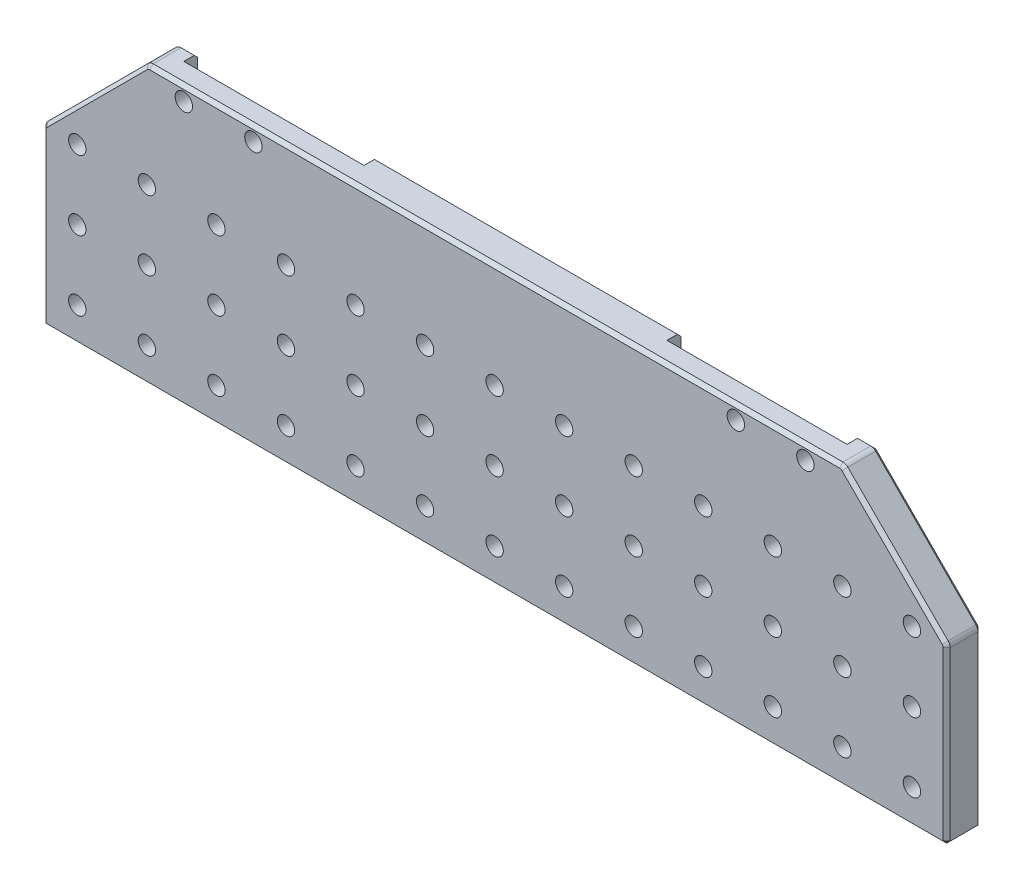
from build123d import *

# Parameters (mm, degrees)
EXTRUDE_1_DEPTH             = 3
EXTRUDE_1_DEPTH_BACK        = 2
SKETCH_2_W                  = 130
SKETCH_2_H                  = 40
SKETCH_6_W                  = 25.903315895
SKETCH_6_H                  = 5
CUT_EXTRUDE_6_DEPTH         = 2
SKETCH_7_R                  = 2.5
CUT_EXTRUDE_7_DEPTH         = 2
CHAMFER_1_SIZE              = 15
M3X0_5_1_D                  = 2.5
M3X0_5_1_DEPTH              = 8.5
M3X0_5_1_TIP                = 0.751075774
FILLET_1_R                  = 1
PATTERN_LINEAR_1_COUNT      = 7
PATTERN_LINEAR_1_PITCH      = 10
PATTERN_LINEAR_1_COUNT_DIR2 = 3
PATTERN_LINEAR_1_PITCH_DIR2 = 10
PATTERN_LINEAR_2_COUNT      = 7
PATTERN_LINEAR_2_PITCH      = 10
PATTERN_LINEAR_2_COUNT_DIR2 = 3
PATTERN_LINEAR_2_PITCH_DIR2 = 10
CHAMFER_2_SIZE              = 0.5


with BuildPart() as part:
    # ｽｹｯﾁ2 → ﾎﾞｽ - 押し出し1 (new, two sides: drawn at the far end of the back side and taken through both)
    with BuildSketch(Plane.XY.offset(-EXTRUDE_1_DEPTH_BACK)):
        with Locations((-80.49999999, -32)):
            Rectangle(SKETCH_2_W, SKETCH_2_H)
    extrude(amount=EXTRUDE_1_DEPTH + EXTRUDE_1_DEPTH_BACK)

    # ｽｹｯﾁ6 → ｶｯﾄ - 押し出し6 (cut)
    with BuildSketch(Plane(origin=(0, 0, -2), x_dir=(-1, 0, 0), z_dir=(0, 0, -1))):
        with Locations((115.230241042, -14.5)):
            Rectangle(SKETCH_6_W, SKETCH_6_H)
        with Locations((45.76975894, -14.5)):
            Rectangle(SKETCH_6_W, SKETCH_6_H)
    extrude(amount=-CUT_EXTRUDE_6_DEPTH, mode=Mode.SUBTRACT)

    # ｽｹｯﾁ7 → ｶｯﾄ - 押し出し7 (cut)
    with BuildSketch(Plane(origin=(0, 0, -2), x_dir=(-1, 0, 0), z_dir=(0, 0, -1))):
        with Locations((33.318100992, -17)):
            Circle(SKETCH_7_R)
        with Locations((128.181898989, -17)):
            Circle(SKETCH_7_R)
        with Locations((102.278583094, -17)):
            Circle(SKETCH_7_R)
        with Locations((58.721416887, -17)):
            Circle(SKETCH_7_R)
    extrude(amount=-CUT_EXTRUDE_7_DEPTH, mode=Mode.SUBTRACT)

    # 面取り1
    chamfer_1_edges = [part.edges().sort_by_distance(p)[0] for p in [
        (-145.49999999, -12, 0.5),
        (-15.49999999, -12, 0.5),
    ]]
    chamfer(chamfer_1_edges, length=CHAMFER_1_SIZE)

    # M3x0.5 ねじ穴1
    with Locations(Plane(origin=(0, 0, 0), x_dir=(-1, 0, 0), z_dir=(0, 0, -1))):
        with Locations((35.818100992, -14), (125.181898989, -14), (45.818100992, -14), (115.181898989, -14)):
            Hole(M3X0_5_1_D / 2, depth=M3X0_5_1_DEPTH)
            with Locations((0, 0, -(M3X0_5_1_DEPTH + M3X0_5_1_TIP / 2))):  # 118° drill point
                Cone(0, M3X0_5_1_D / 2, M3X0_5_1_TIP, mode=Mode.SUBTRACT)

    # ﾌｨﾚｯﾄ1
    fillet_1_edges = [part.edges().sort_by_distance(p)[0] for p in [
        (-30.49999999, -12, 0.5),
        (-130.49999999, -12, 0.5),
        (-145.49999999, -27, 0.5),
        (-15.49999999, -27, 0.5),
    ]]
    fillet(fillet_1_edges, radius=FILLET_1_R)

    # ｽｹｯﾁ11 → M3x0.5 ねじ穴2 (revolve, cut)
    with BuildSketch(Plane(origin=(-80.49999999, -47, -2), x_dir=(0, 1, 0), z_dir=(1, 0, 0))):
        Polygon((0, 0), (0, 9.251075774), (1.25, 8.5), (1.25, 0), align=None)
    m3x0_5_2 = revolve(axis=Axis((-80.49999999, -47, -8.35), (0, 0, 1)), mode=Mode.SUBTRACT)

    # 直線ﾊﾟﾀｰﾝ1: M3x0.5 _2 7 × 3
    with Locations(*[(i * PATTERN_LINEAR_1_PITCH, j * PATTERN_LINEAR_1_PITCH_DIR2, 0) for i in range(PATTERN_LINEAR_1_COUNT) for j in range(PATTERN_LINEAR_1_COUNT_DIR2) if (i, j) != (0, 0)]):
        add(m3x0_5_2, mode=Mode.SUBTRACT)

    # 直線ﾊﾟﾀｰﾝ2: M3x0.5 _2 7 × 3
    with Locations(*[(-i * PATTERN_LINEAR_2_PITCH, j * PATTERN_LINEAR_2_PITCH_DIR2, 0) for i in range(PATTERN_LINEAR_2_COUNT) for j in range(PATTERN_LINEAR_2_COUNT_DIR2) if (i, j) != (0, 0)]):
        add(m3x0_5_2, mode=Mode.SUBTRACT)

    # 面取り2
    chamfer_2_edges = [part.edges().sort_by_distance(p)[0] for p in [
        (-15.49999999, -39.707106781, -2),
        (-80.49999999, -52, 3),
        (-15.49999999, -39.707106781, 3),
        (-145.49999999, -39.707106781, 3),
        (-145.49999999, -39.707106781, -2),
        (-137.99999999, -19.5, -2),
        (-31.866157273, -12, -2),
        (-22.99999999, -19.5, -2),
        (-15.576120458, -27.03153013, -2),
        (-30.53153012, -12.076120467, -2),
        (-130.46846986, -12.076120467, -2),
        (-145.423879523, -27.03153013, -2),
        (-137.99999999, -19.5, 3),
        (-80.49999999, -12, 3),
        (-22.99999999, -19.5, 3),
        (-15.576120458, -27.03153013, 3),
        (-30.53153012, -12.076120467, 3),
        (-130.46846986, -12.076120467, 3),
        (-145.423879523, -27.03153013, 3),
        (-80.49999999, -12, -2),
        (-129.133842708, -12, -2),
        (-80.49999999, -52, -2),
        (-15.49999999, -52, 0.5),
        (-145.49999999, -52, 0.5),
    ]]
    chamfer(chamfer_2_edges, length=CHAMFER_2_SIZE)


solid = part.part
